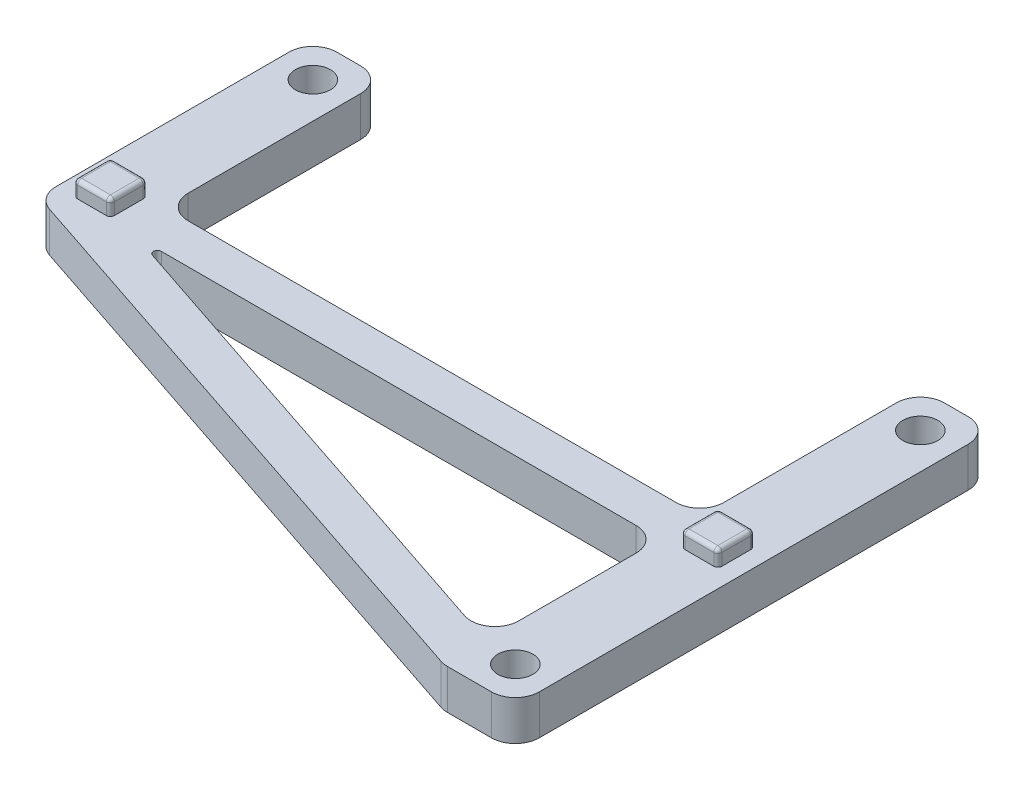
from build123d import *

# Parameters (mm, degrees)
SKETCH1_R           = 2.2
BOSS_EXTRUDE1_DEPTH = 5
BOSS_EXTRUDE2_START = 5
SKETCH1_3_W         = 4.6228
SKETCH1_3_H         = 4.6228
BOSS_EXTRUDE2_DEPTH = 2
FILLET1_R           = 3
FILLET2_R           = 0.508
FILLET3_R           = 0.5


with BuildPart() as part:
    # Sketch1 → Boss-Extrude1 (new body)
    with BuildSketch(Plane(origin=(0, 0, 0), x_dir=(1, 0, 0), z_dir=(0, 1, 0))):
        Polygon((-80.7, 4.5), (-71.7, 4.5), (-71.7, -23.15), (-4.5, -23.15), (-4.5, 4.5), (4.5, 4.5), (4.5, -55.3), (-4.5, -55.3), (-80.7, -29.9), align=None)
        with Locations(Location((0, 0, 0), (0, 0, 270))):
            Circle(SKETCH1_R, mode=Mode.SUBTRACT)
        with Locations(Location((-76.2, 0, 0), (0, 0, 270))):
            Circle(SKETCH1_R, mode=Mode.SUBTRACT)
        with Locations(Location((0, -50.8, 0), (0, 0, 270))):
            Circle(SKETCH1_R, mode=Mode.SUBTRACT)
        Polygon((-70.138611699, -28.15), (-4.5, -28.15), (-4.5, -50.029537233), align=None, mode=Mode.SUBTRACT)
    extrude(amount=BOSS_EXTRUDE1_DEPTH)

    # Sketch1<3> → Boss-Extrude2 (add)
    with BuildSketch(Plane(origin=(0, 0, 0), x_dir=(1, 0, 0), z_dir=(0, 1, 0)).offset(BOSS_EXTRUDE2_START)):
        with Locations((-76.2, -25.4)):
            Rectangle(SKETCH1_3_W, SKETCH1_3_H)
        with Locations((0, -25.4)):
            Rectangle(SKETCH1_3_W, SKETCH1_3_H)
    extrude(amount=BOSS_EXTRUDE2_DEPTH)

    # Fillet1
    fillet1_edges = [part.edges().sort_by_distance(p)[0] for p in [
        (-4.5, 2.5, 28.15),
        (-4.5, 2.5, 50.029537233),
        (-80.7, 2.5, -4.5),
        (-71.7, 2.5, -4.5),
        (-71.7, 2.5, 23.15),
        (-4.5, 2.5, 23.15),
        (-4.5, 2.5, -4.5),
        (4.5, 2.5, -4.5),
        (4.5, 2.5, 55.3),
        (-4.5, 2.5, 55.3),
        (-80.7, 2.5, 29.9),
    ]]
    fillet(fillet1_edges, radius=FILLET1_R)

    # Fillet2
    fillet2_edges = [part.edges().sort_by_distance(p)[0] for p in [
        (-78.5114, 6, 23.0886),
        (-76.2, 7, 27.7114),
        (-78.5114, 6, 27.7114),
        (-73.8886, 7, 25.4),
        (-73.8886, 6, 27.7114),
        (-73.8886, 6, 23.0886),
        (-78.5114, 7, 25.4),
        (-76.2, 7, 23.0886),
        (-2.3114, 6, 23.0886),
        (0, 7, 27.7114),
        (-2.3114, 6, 27.7114),
        (2.3114, 7, 25.4),
        (2.3114, 6, 27.7114),
        (2.3114, 6, 23.0886),
        (-2.3114, 7, 25.4),
        (0, 7, 23.0886),
    ]]
    fillet(fillet2_edges, radius=FILLET2_R)

    # Fillet3
    fillet3_edges = [part.edges().sort_by_distance(p)[0] for p in [
        (-70.138611699, 2.5, 28.15),
    ]]
    fillet(fillet3_edges, radius=FILLET3_R)


solid = part.part
